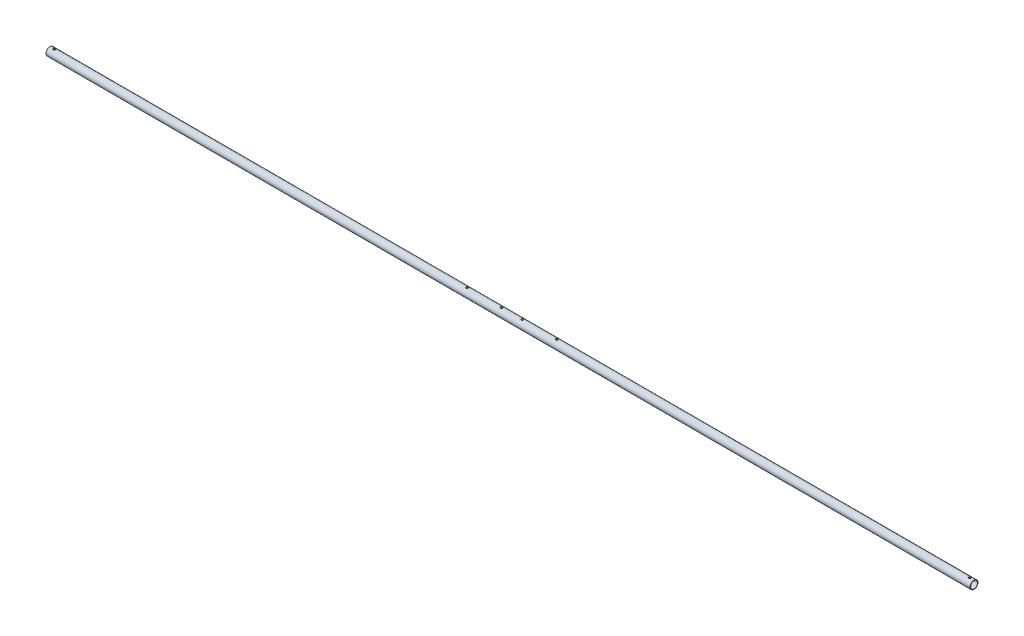
from build123d import *

# Parameters (mm, degrees)
SKETCH3_R               = 11.7094
SKETCH3_R_2             = 10.4648
BOSS_EXTRUDE1_DEPTH     = 2724.912
CUT_EXTRUDE1_DEPTH      = 2725.962316774
CUT_EXTRUDE1_DEPTH_BACK = 2725.962316774
SKETCH4_R               = 3.175
CUT_EXTRUDE2_DEPTH      = 2725.962316875
CUT_EXTRUDE2_DEPTH_BACK = 2725.962316875
SKETCH5_R               = 3.175


with BuildPart() as part:
    # Sketch3 → Boss-Extrude1 (new body)
    with BuildSketch(Plane(origin=(0, 0, 0), x_dir=(0, 0, -1), z_dir=(1, 0, 0))):
        Circle(SKETCH3_R)
        Circle(SKETCH3_R_2, mode=Mode.SUBTRACT)
    extrude(amount=BOSS_EXTRUDE1_DEPTH)

    # Sketch4 → Cut-Extrude1 (cut, two sides: drawn at the far end of the back side and taken through both)
    with BuildSketch(Plane(origin=(0, 0, 0), x_dir=(1, 0, 0), z_dir=(0, 1, 0)).offset(-CUT_EXTRUDE1_DEPTH_BACK)):
        with Locations(Location((1331.976, 0, 0), (0, 0, 270))):
            Circle(SKETCH4_R)
        with Locations(Location((1392.936, 0, 0), (0, 0, 270))):
            Circle(SKETCH4_R)
        with Locations(Location((1494.6376, 0, 0), (0, 0, 270))):
            Circle(SKETCH4_R)
        with Locations(Location((1230.2744, 0, 0), (0, 0, 270))):
            Circle(SKETCH4_R)
    extrude(amount=CUT_EXTRUDE1_DEPTH + CUT_EXTRUDE1_DEPTH_BACK, mode=Mode.SUBTRACT)

    # Sketch5 → Cut-Extrude2 (cut, two sides: drawn at the far end of the back side and taken through both)
    with BuildSketch(Plane(origin=(0, 0, 0), x_dir=(1, 0, 0), z_dir=(0, 1, 0)).offset(-CUT_EXTRUDE2_DEPTH_BACK)):
        with Locations(Location((12.7, 0, 0), (0, 0, 270))):
            Circle(SKETCH5_R)
        with Locations(Location((2712.212, 0, 0), (0, 0, 270))):
            Circle(SKETCH5_R)
    extrude(amount=CUT_EXTRUDE2_DEPTH + CUT_EXTRUDE2_DEPTH_BACK, mode=Mode.SUBTRACT)


solid = part.part
